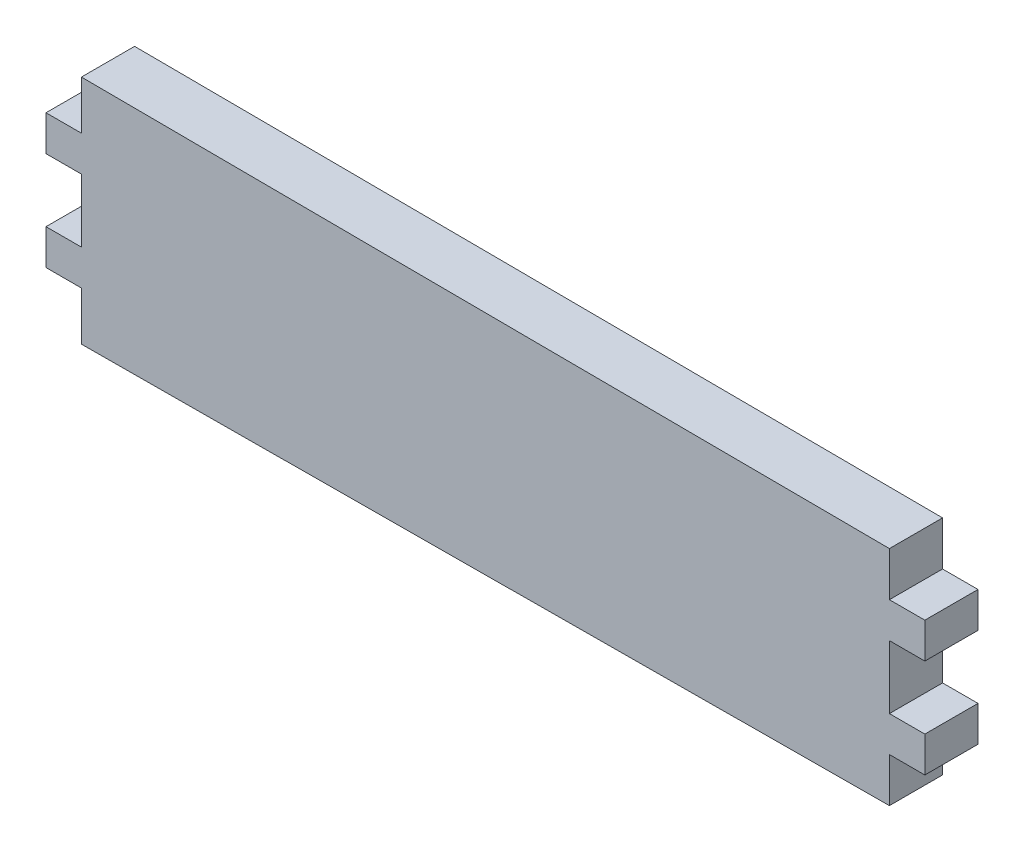
from build123d import *

# Parameters (mm, degrees)
BOSS_EXTRUDE1_DEPTH = 4.7625


with BuildPart() as part:
    # Sketch1 → Boss-Extrude1 (new body)
    with BuildSketch(Plane.XY):
        Polygon((220.107868923, -23.321505778), (216.932868923, -23.321505778), (216.932868923, -26.496505778), (220.107868923, -26.496505778), (220.107868923, -32.160705778), (216.932868923, -32.160705778), (216.932868923, -35.335705778), (220.107868923, -35.335705778), (220.107868923, -39.693563587), (292.497868923, -39.302441805), (292.497868923, -35.335705778), (295.672868923, -35.335705778), (295.672868923, -32.160705778), (292.497868923, -32.160705778), (292.497868923, -26.496505778), (295.672868923, -26.496505778), (295.672868923, -23.321505778), (292.497868923, -23.321505778), (292.497868923, -19.354575863), (220.107868923, -18.963684396), align=None)
    extrude(amount=BOSS_EXTRUDE1_DEPTH)


solid = part.part
